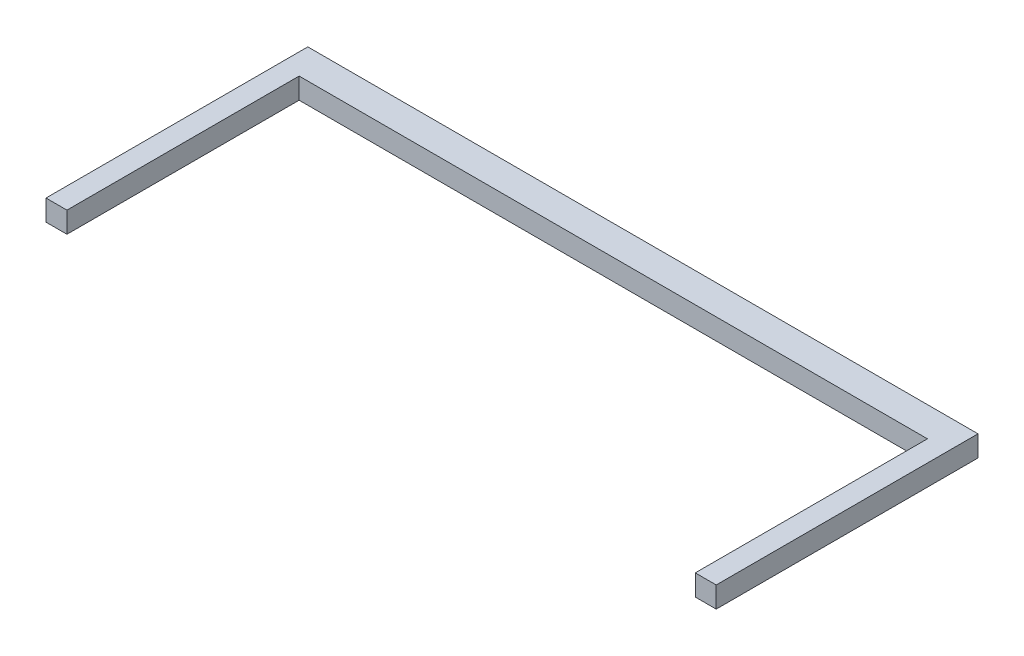
from build123d import *

# Parameters (mm, degrees)
BOSS_EXTRUDE1_DEPTH = 20


with BuildPart() as part:
    # Sketch1 → Boss-Extrude1 (new body)
    with BuildSketch(Plane(origin=(0, 0, 0), x_dir=(1, 0, 0), z_dir=(0, 1, 0))):
        Polygon((0, 0), (0, -250), (20, -250), (20, -230), (20, -28.284271247), (620, -28.284271247), (620, -230), (620, -250), (640, -250), (640, 0), (620, 0), (20, 0), align=None)
    extrude(amount=BOSS_EXTRUDE1_DEPTH)


solid = part.part
